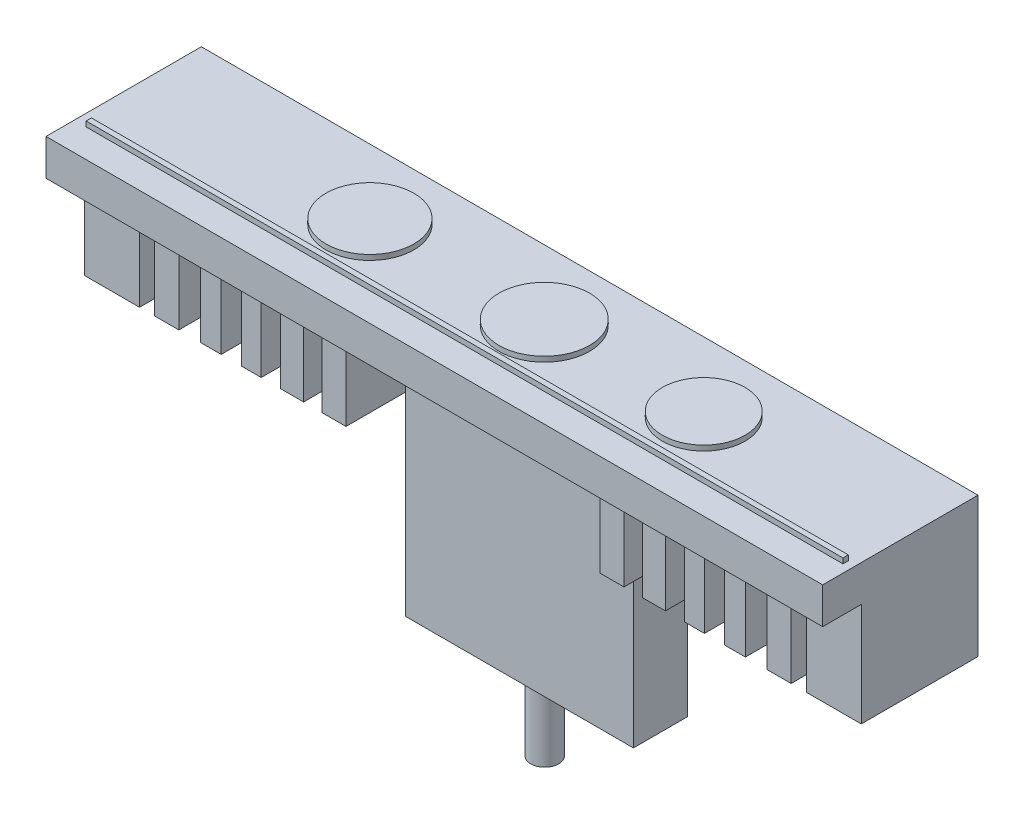
from build123d import *

# Parameters (mm, degrees)
SKETCH1_W           = 150
SKETCH1_H           = 30
BOSS_EXTRUDE1_DEPTH = 7
SKETCH2_R           = 8.492301233
SKETCH2_R_2         = 8.746428368
SKETCH2_R_3         = 7.993391254
SKETCH2_W           = 146.177010272
SKETCH2_H           = 1.023518213
BOSS_EXTRUDE2_DEPTH = 1
SKETCH3_W           = 10.614560987
SKETCH3_H           = 22.545060987
SKETCH3_W_2         = 4.652355514
SKETCH3_W_3         = 4.001025742
SKETCH3_W_4         = 3.814931522
SKETCH3_W_5         = 4.466261294
SKETCH3_W_6         = 4.652355515
BOSS_EXTRUDE3_DEPTH = 20
SKETCH4_W           = 44.01124784
SKETCH4_H           = 10.469759529
BOSS_EXTRUDE4_DEPTH = 55
SKETCH5_R           = 2.698367098
BOSS_EXTRUDE5_DEPTH = 15


with BuildPart() as part:
    # Sketch1 → Boss-Extrude1 (new body)
    with BuildSketch(Plane(origin=(0, 0, 0), x_dir=(1, 0, 0), z_dir=(0, 1, 0))):
        with Locations((75, 15)):
            Rectangle(SKETCH1_W, SKETCH1_H)
    extrude(amount=BOSS_EXTRUDE1_DEPTH)

    # Sketch2 → Boss-Extrude2 (add)
    with BuildSketch(Plane(origin=(0, 7, 0), x_dir=(1, 0, 0), z_dir=(0, 1, 0))):
        with Locations(Location((46.015825143, 16.53527732, 0), (0, 0, 90))):
            Circle(SKETCH2_R)
        with Locations(Location((79.69887907, 16.53527732, 0), (0, 0, 90))):
            Circle(SKETCH2_R_2)
        with Locations(Location((110.497472577, 16.53527732, 0), (0, 0, 90))):
            Circle(SKETCH2_R_3)
        with Locations((75.372188441, 5.974430301)):
            Rectangle(SKETCH2_W, SKETCH2_H)
    extrude(amount=BOSS_EXTRUDE2_DEPTH)

    # Sketch3 → Boss-Extrude3 (add)
    with BuildSketch(Plane.XZ):
        with Locations((144.692719506, -18.727469507)):
            Rectangle(SKETCH3_W, SKETCH3_H)
        with Locations((134.131438592, -18.727469507)):
            Rectangle(SKETCH3_W_2, SKETCH3_H)
        with Locations((125.617628, -18.727469507)):
            Rectangle(SKETCH3_W_3, SKETCH3_H)
        with Locations((117.801670735, -18.727469507)):
            Rectangle(SKETCH3_W_4, SKETCH3_H)
        with Locations((109.939189915, -18.727469507)):
            Rectangle(SKETCH3_W_5, SKETCH3_H)
        with Locations((101.844091319, -18.727469507)):
            Rectangle(SKETCH3_W_6, SKETCH3_H)
        with Locations((48.155908681, -18.727469507)):
            Rectangle(SKETCH3_W_6, SKETCH3_H)
        with Locations((40.060810085, -18.727469507)):
            Rectangle(SKETCH3_W_5, SKETCH3_H)
        with Locations((32.198329265, -18.727469507)):
            Rectangle(SKETCH3_W_4, SKETCH3_H)
        with Locations((24.382372, -18.727469507)):
            Rectangle(SKETCH3_W_3, SKETCH3_H)
        with Locations((15.868561408, -18.727469507)):
            Rectangle(SKETCH3_W_2, SKETCH3_H)
        with Locations((5.307280494, -18.727469507)):
            Rectangle(SKETCH3_W, SKETCH3_H)
    extrude(amount=BOSS_EXTRUDE3_DEPTH)

    # Sketch4 → Boss-Extrude4 (add)
    with BuildSketch(Plane.XZ):
        with Locations((75, -21.677122954)):
            Rectangle(SKETCH4_W, SKETCH4_H)
    extrude(amount=BOSS_EXTRUDE4_DEPTH)

    # Sketch5 → Boss-Extrude5 (add)
    with BuildSketch(Plane.XZ.offset(55)):
        with Locations(Location((74.767407147, -21.559835962, 0), (0, 0, 270))):
            Circle(SKETCH5_R)
    extrude(amount=BOSS_EXTRUDE5_DEPTH)


solid = part.part
